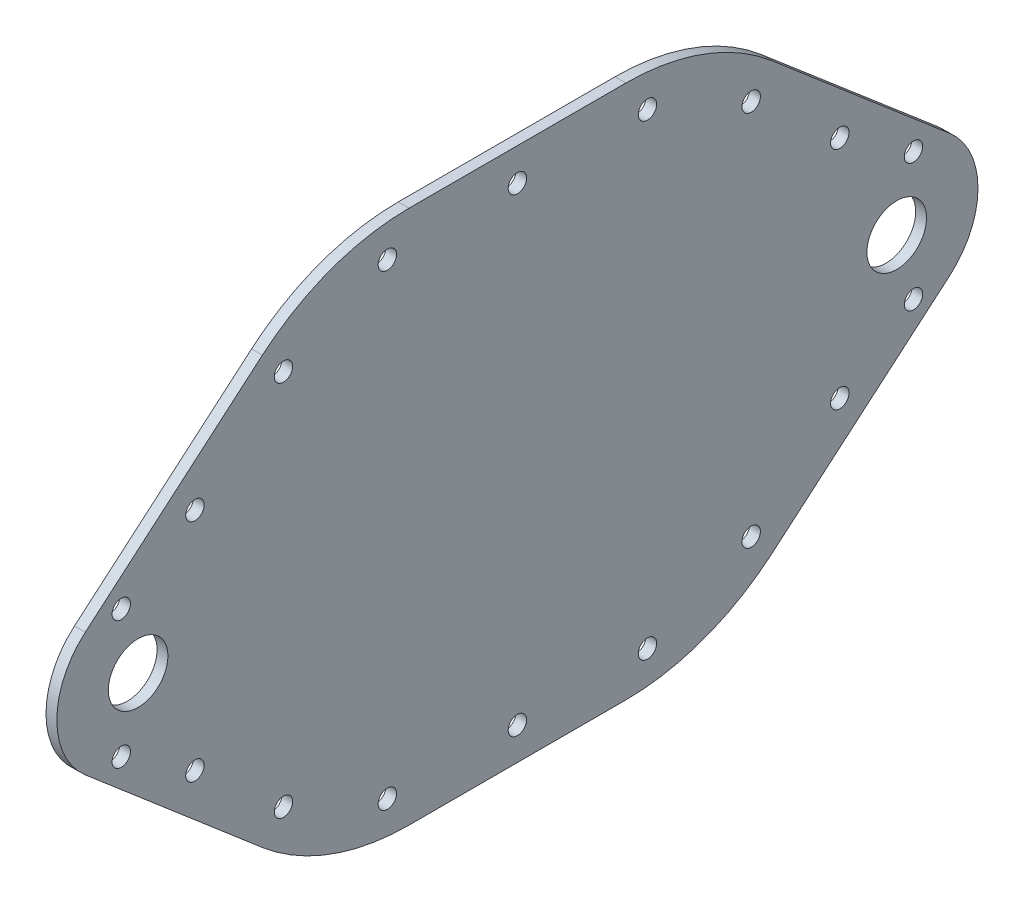
from build123d import *

# Parameters (mm, degrees)
SKETCH1_R               = 19.05
BOSS_EXTRUDE1_DEPTH     = 2.54
CUT_EXTRUDE3_DEPTH      = 125.81903469
CUT_EXTRUDE3_DEPTH_BACK = 125.81903469
SKETCH4_R               = 2.159
SKETCH5_R               = 6.985
CUT_EXTRUDE4_DEPTH      = 6.35


with BuildPart() as part:
    # Sketch1 → Boss-Extrude1 (new body)
    with BuildSketch(Plane(origin=(0, 0, 0), x_dir=(0, 0, -1), z_dir=(1, 0, 0))):
        with BuildLine():
            Line((25.4, 62.611), (-25.4, 62.611))
            ThreePointArc((-25.4, 62.611), (-43.71389723, 59.350669702), (-59.777434529, 49.970298982))
            Line((-59.777434529, 49.970298982), (-101.281034529, 14.478))
            ThreePointArc((-101.281034529, 14.478), (-80.929937509, 17.302618411), (-69.85, 0))
            ThreePointArc((-69.85, 0), (-80.929937509, -17.302618411), (-101.281034529, -14.478))
            Line((-101.281034529, -14.478), (-59.777434529, -49.970298982))
            ThreePointArc((-59.777434529, -49.970298982), (-43.71389723, -59.350669702), (-25.4, -62.611))
            Line((-25.4, -62.611), (25.4, -62.611))
            ThreePointArc((25.4, -62.611), (43.699078076, -59.34404997), (59.737214243, -49.946847768))
            Line((59.737214243, -49.946847768), (101.269374674, -14.487973703))
            ThreePointArc((101.269374674, -14.487973703), (69.85, -7.706e-06), (101.269379322, 14.48794821))
            Line((101.269379322, 14.48794821), (59.737230268, 49.9468356))
            ThreePointArc((59.737230268, 49.9468356), (43.699087699, 59.344046737), (25.4, 62.611))
        make_face()
        with Locations((88.9, -1.0762e-05)):
            Circle(SKETCH1_R)
        with Locations((-88.9, 0)):
            Circle(SKETCH1_R)
    extrude(amount=BOSS_EXTRUDE1_DEPTH)

    # Sketch4 → Cut-Extrude3 (cut, two sides: drawn at the far end of the back side and taken through both)
    with BuildSketch(Plane(origin=(2.54, 0, 0), x_dir=(0, 0, -1), z_dir=(1, 0, 0)).offset(-CUT_EXTRUDE3_DEPTH_BACK)):
        with Locations((-30.48, 54.706186836)):
            Circle(SKETCH4_R)
        with Locations((-54.833341451, 44.171983407)):
            Circle(SKETCH4_R)
        with Locations((54.789478539, 44.151652011)):
            Circle(SKETCH4_R)
        with Locations((30.478659799, 54.70517335)):
            Circle(SKETCH4_R)
        with Locations((-75.580981084, 26.429391704)):
            Circle(SKETCH4_R)
        with Locations((75.555553066, 26.422208316)):
            Circle(SKETCH4_R)
        with Locations((0, 54.991)):
            Circle(SKETCH4_R)
        with Locations((-92.852981084, 14.999391704)):
            Circle(SKETCH4_R)
        with Locations((92.827553066, 14.992208316)):
            Circle(SKETCH4_R)
        with Locations((92.827553066, -14.992208316)):
            Circle(SKETCH4_R)
        with Locations((75.555553066, -26.422208316)):
            Circle(SKETCH4_R)
        with Locations((54.789478539, -44.151652011)):
            Circle(SKETCH4_R)
        with Locations((30.478659799, -54.70517335)):
            Circle(SKETCH4_R)
        with Locations((0, -54.991)):
            Circle(SKETCH4_R)
        with Locations((-30.48, -54.706186836)):
            Circle(SKETCH4_R)
        with Locations((-54.833341451, -44.171983407)):
            Circle(SKETCH4_R)
        with Locations((-75.580981084, -26.429391704)):
            Circle(SKETCH4_R)
        with Locations((-92.852981084, -14.999391704)):
            Circle(SKETCH4_R)
    extrude(amount=CUT_EXTRUDE3_DEPTH + CUT_EXTRUDE3_DEPTH_BACK, mode=Mode.SUBTRACT)

    # Sketch5 → Cut-Extrude4 (cut)
    with BuildSketch(Plane(origin=(2.54, 0, 0), x_dir=(0, 0, -1), z_dir=(1, 0, 0))):
        with Locations((-88.9, 0)):
            Circle(SKETCH5_R)
        with Locations((88.9, -1.0762e-05)):
            Circle(SKETCH5_R)
    extrude(amount=-CUT_EXTRUDE4_DEPTH, mode=Mode.SUBTRACT)


solid = part.part
